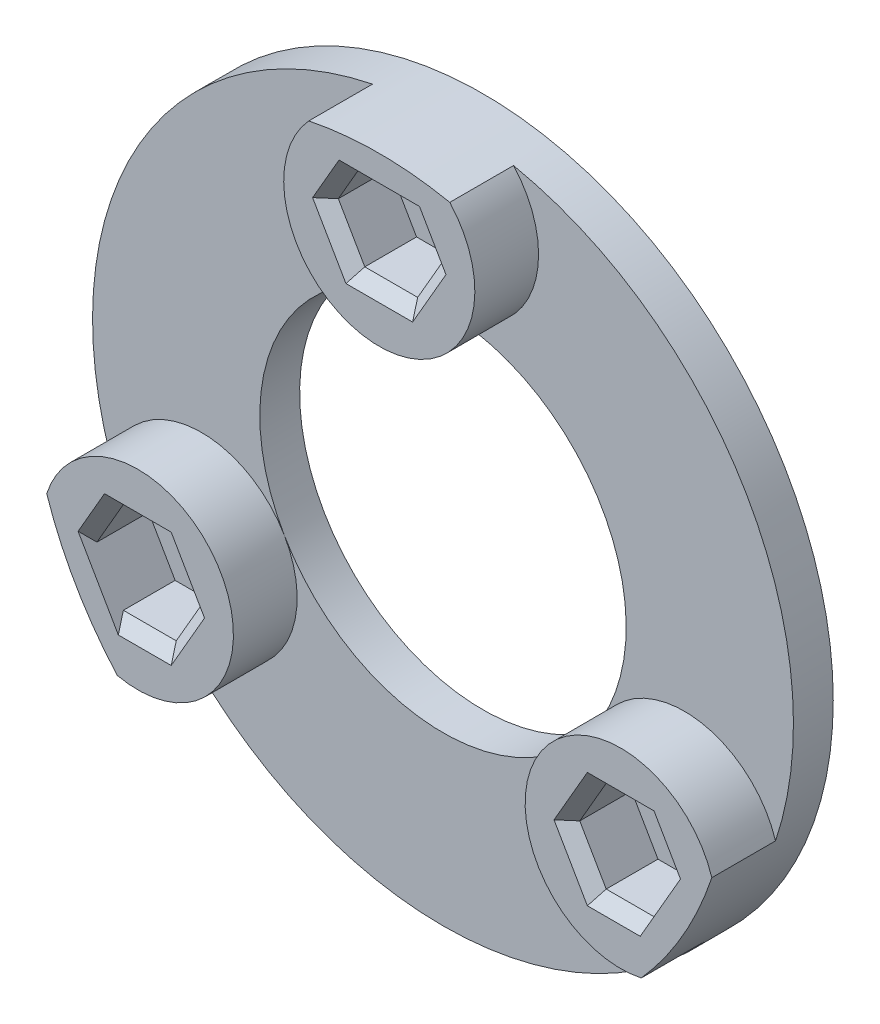
from build123d import *

# Parameters (mm, degrees)
SKETCH1_R           = 22
SKETCH1_R_2         = 11.5
SKETCH1_R_3         = 1.65
BOSS_EXTRUDE1_DEPTH = 2.5
BOSS_EXTRUDE2_DEPTH = 4
CHAMFER1_SIZE       = 0.75


with BuildPart() as part:
    # Sketch1 → Boss-Extrude1 (new body)
    with BuildSketch(Plane.XY):
        Circle(SKETCH1_R)
        Circle(SKETCH1_R_2, mode=Mode.SUBTRACT)
        with Locations((0, 17.5)):
            Circle(SKETCH1_R_3, mode=Mode.SUBTRACT)
        with Locations((15.155444566, -8.75)):
            Circle(SKETCH1_R_3, mode=Mode.SUBTRACT)
        with Locations((-15.155444566, -8.75)):
            Circle(SKETCH1_R_3, mode=Mode.SUBTRACT)
    extrude(amount=BOSS_EXTRUDE1_DEPTH)

    # Sketch2 → Boss-Extrude2 (add)
    # profile 1 of 3: a face of its own
    with BuildSketch(Plane.XY.offset(2.5)):
        with BuildLine():
            ThreePointArc((4.426906369, 21.55), (0, 22), (-4.426906369, 21.55))
            ThreePointArc((-4.426906369, 21.55), (0, 11.5), (4.426906369, 21.55))
        make_face()
        Polygon((1.659882024, 20.375), (3.319764048, 17.5), (1.659882024, 14.625), (-1.659882024, 14.625), (-3.319764048, 17.5), (-1.659882024, 20.375), align=None, mode=Mode.SUBTRACT)
    # profile 2 of 3: a face of its own
    with BuildSketch(Plane.XY.offset(2.5)):
        with BuildLine():
            ThreePointArc((-16.449394267, -14.608813376), (-9.959292144, -5.75), (-20.876300636, -6.941186624))
            ThreePointArc((-20.876300636, -6.941186624), (-19.052558883, -11), (-16.449394267, -14.608813376))
        make_face()
        Polygon((-18.475208614, -8.75), (-16.81532659, -5.875), (-13.495562542, -5.875), (-11.835680518, -8.75), (-13.495562542, -11.625), (-16.81532659, -11.625), align=None, mode=Mode.SUBTRACT)
    # profile 3 of 3: a face of its own
    with BuildSketch(Plane.XY.offset(2.5)):
        with BuildLine():
            ThreePointArc((16.449394267, -14.608813376), (19.052558883, -11), (20.876300636, -6.941186624))
            ThreePointArc((20.876300636, -6.941186624), (9.959292144, -5.75), (16.449394267, -14.608813376))
        make_face()
        Polygon((16.81532659, -11.625), (13.495562542, -11.625), (11.835680518, -8.75), (13.495562542, -5.875), (16.81532659, -5.875), (18.475208614, -8.75), align=None, mode=Mode.SUBTRACT)
    extrude(amount=BOSS_EXTRUDE2_DEPTH)

    # Chamfer1
    chamfer1_edges = [part.edges().sort_by_distance(p)[0] for p in [
        (2.489823036, 16.0625, 6.5),
        (0, 14.625, 6.5),
        (-2.489823036, 16.0625, 6.5),
        (-2.489823036, 18.9375, 6.5),
        (2.489823036, 18.9375, 6.5),
        (-15.155444566, -5.875, 6.5),
        (-12.66562153, -7.3125, 6.5),
        (-12.66562153, -10.1875, 6.5),
        (-15.155444566, -11.625, 6.5),
        (-17.645267602, -7.3125, 6.5),
        (12.66562153, -10.1875, 6.5),
        (12.66562153, -7.3125, 6.5),
        (15.155444566, -5.875, 6.5),
        (17.645267602, -7.3125, 6.5),
        (15.155444566, -11.625, 6.5),
    ]]
    chamfer(chamfer1_edges, length=CHAMFER1_SIZE)


solid = part.part
